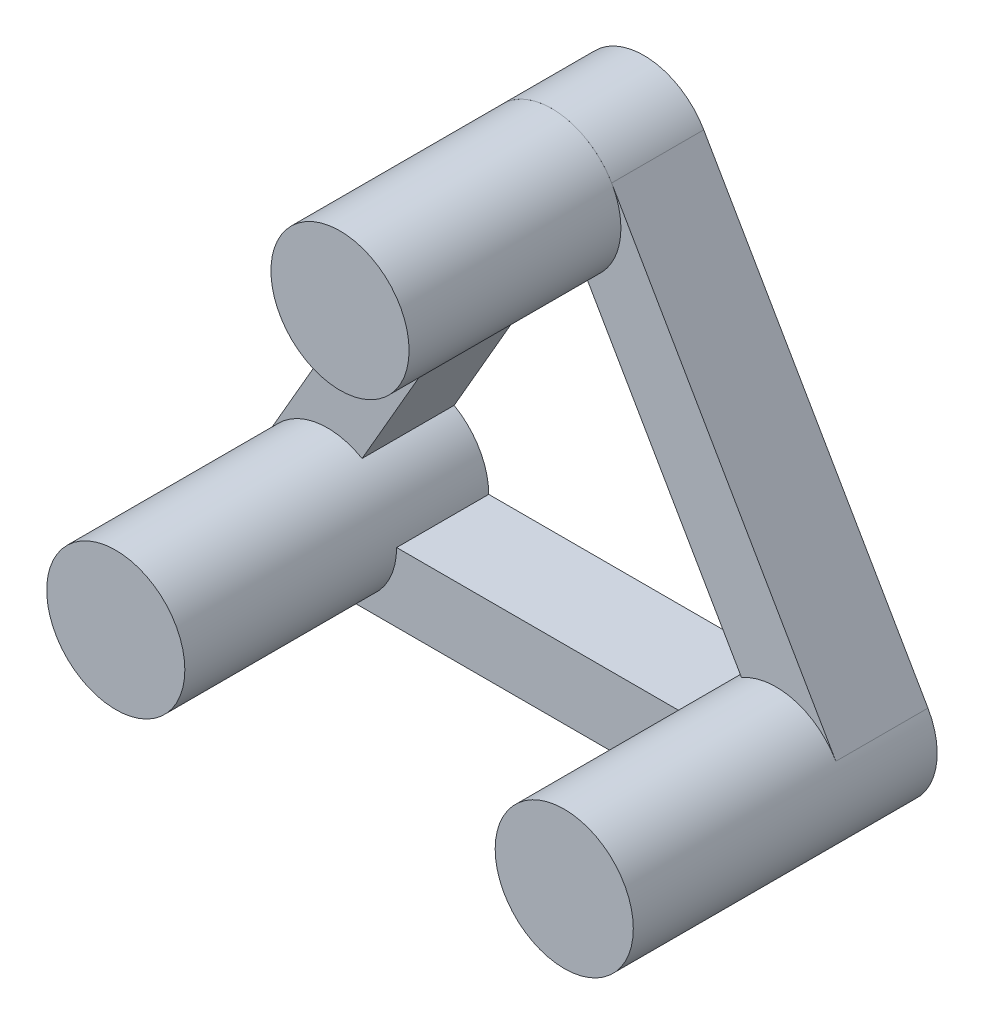
from build123d import *

# Parameters (mm, degrees)
SALIENTE_EXTRUIR1_DEPTH = 2
CROQUIS2_R              = 1.5
SALIENTE_EXTRUIR4_DEPTH = 4.6


with BuildPart() as part:
    # Croquis1 → Saliente-Extruir1 (new body)
    with BuildSketch(Plane.XY):
        with BuildLine():
            Line((-1.249573298, 6.373923256), (-6.119309861, -2.067772542))
            ThreePointArc((-6.119309861, -2.067772542), (-6.118902164, -3.56753706), (-4.82, -4.317301652))
            Line((-4.82, -4.317301652), (4.92, -4.317301652))
            ThreePointArc((4.92, -4.317301652), (6.218902164, -3.56753706), (6.219309861, -2.067772542))
            Line((6.219309861, -2.067772542), (1.349573298, 6.373923256))
            ThreePointArc((1.349573298, 6.373923256), (0.05, 7.124546306), (-1.249573298, 6.373923256))
        make_face()
        with BuildLine():
            Line((-0.699721633, 4.324692275), (-4.070430344, -1.518015182))
            ThreePointArc((-4.070430344, -1.518015182), (-3.52108613, -2.067086511), (-3.32, -2.817301652))
            Line((-3.32, -2.817301652), (3.42, -2.817301652))
            ThreePointArc((3.42, -2.817301652), (3.62108613, -2.067086511), (4.170430344, -1.518015182))
            Line((4.170430344, -1.518015182), (0.799721633, 4.324692275))
            ThreePointArc((0.799721633, 4.324692275), (0.05, 4.12393805), (-0.699721633, 4.324692275))
        make_face(mode=Mode.SUBTRACT)
    extrude(amount=SALIENTE_EXTRUIR1_DEPTH)

    # Croquis2 → Saliente-Extruir4 (add)
    with BuildSketch(Plane.XY.offset(2)):
        with Locations((0.05, 5.624242178)):
            Circle(CROQUIS2_R)
        with Locations(Location((4.92, -2.817301652, 0), (0, 0, 180))):
            Circle(CROQUIS2_R)
        with Locations((-4.82, -2.817301652)):
            Circle(CROQUIS2_R)
    extrude(amount=SALIENTE_EXTRUIR4_DEPTH)


solid = part.part
